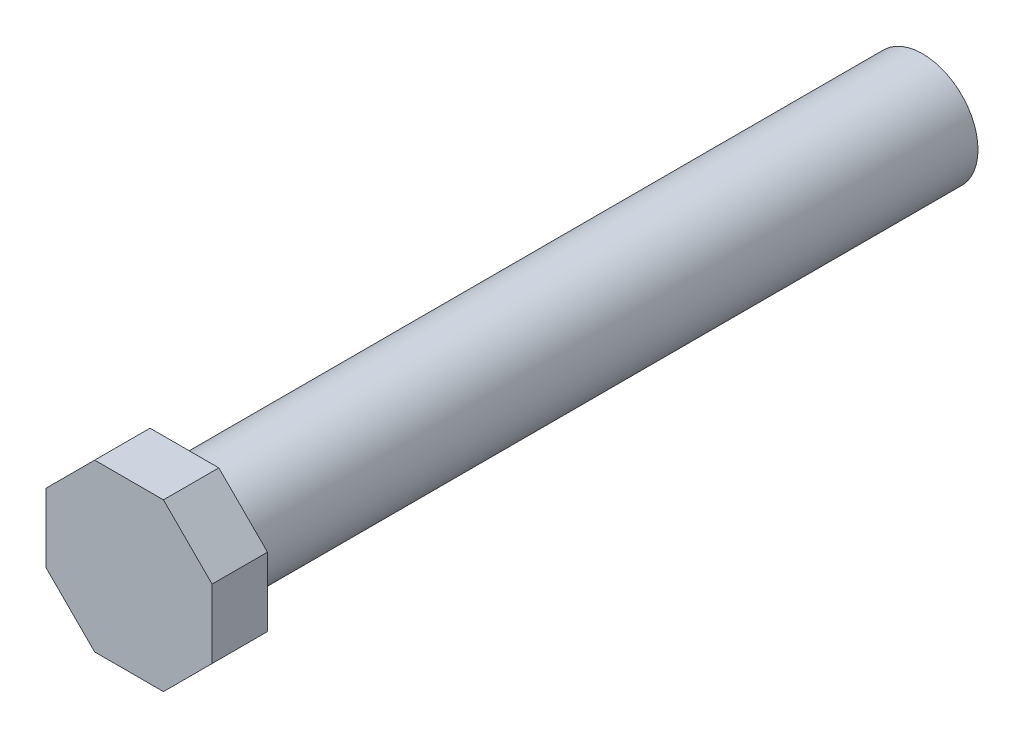
from build123d import *

# Parameters (mm, degrees)
SKETCH1_R           = 3
BOSS_EXTRUDE1_DEPTH = 40
BOSS_EXTRUDE2_DEPTH = 3


with BuildPart() as part:
    # Sketch1 → Boss-Extrude1 (new body)
    with BuildSketch(Plane.XY):
        Circle(SKETCH1_R)
    extrude(amount=BOSS_EXTRUDE1_DEPTH)

    # Sketch2 → Boss-Extrude2 (add)
    with BuildSketch(Plane.XY.offset(40)):
        Polygon((-1.863961031, -4.5), (1.863961031, -4.5), (4.5, -1.863961031), (4.5, 1.863961031), (1.863961031, 4.5), (-1.863961031, 4.5), (-4.5, 1.863961031), (-4.5, -1.863961031), align=None)
    extrude(amount=BOSS_EXTRUDE2_DEPTH)


solid = part.part
